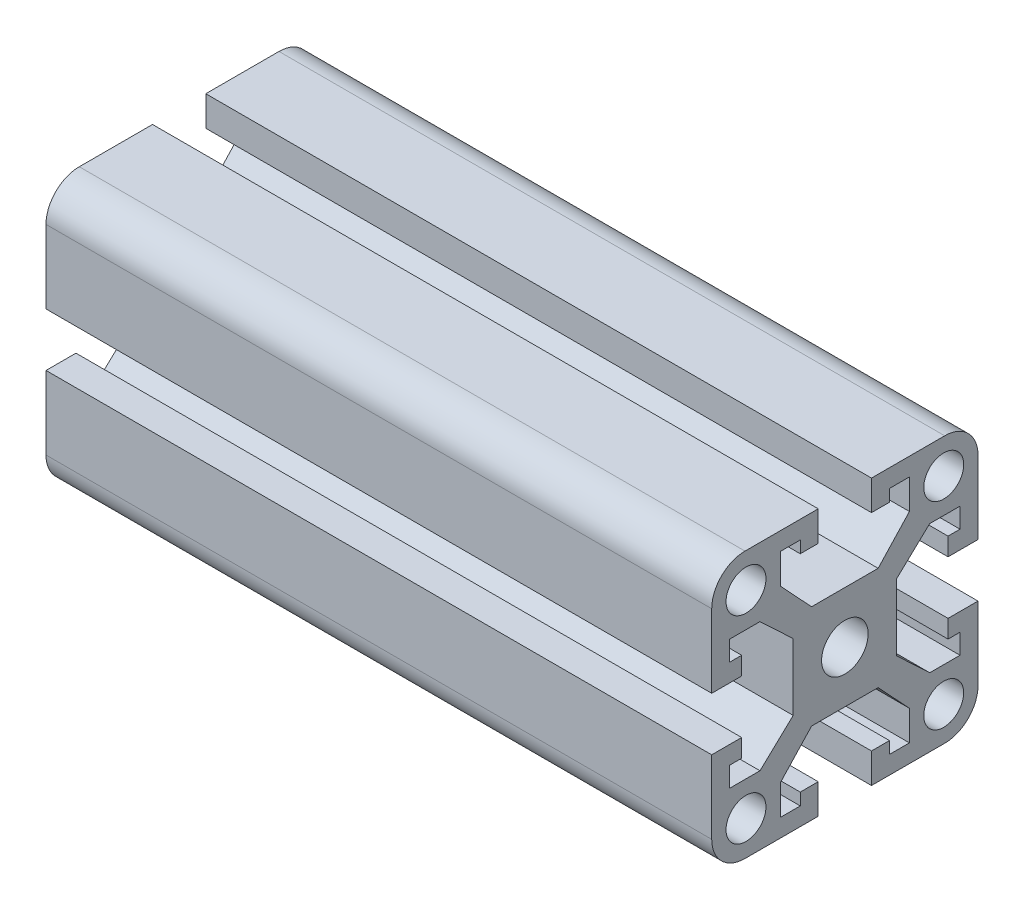
from build123d import *

# Parameters (mm, degrees)
SKETCH_1_W          = 40
SKETCH_1_H          = 40
EXTRUDE_1_DEPTH     = 100
CUT_EXTRUDE_1_REACH = 131.283
SKETCH_2_R          = 3.5
SKETCH_2_R_2        = 3
FILLET_1_R          = 5
SKETCH_3_R          = 1.236693346
CUT_EXTRUDE_2_DEPTH = 0.5


with BuildPart() as part:
    # 草图1 → 凸台-拉伸1 (new body)
    with BuildSketch(Plane(origin=(0, 0, 0), x_dir=(0, 0, -1), z_dir=(1, 0, 0))):
        with Locations((40.704960836, 35.035758607)):
            Rectangle(SKETCH_1_W, SKETCH_1_H)
    extrude(amount=EXTRUDE_1_DEPTH)

    # 草图2 → 切除-拉伸1 (cut, up to next)
    with BuildSketch(Plane(origin=(100, 0, 0), x_dir=(0, 0, -1), z_dir=(1, 0, 0)), mode=Mode.PRIVATE) as cut_extrude_1_sk1:
        with Locations((40.704960836, 35.035758607)):
            Circle(SKETCH_2_R)
    cut_extrude_1_tool1 = extrude(cut_extrude_1_sk1.sketch, amount=-CUT_EXTRUDE_1_REACH, mode=Mode.PRIVATE) & part.part
    # 草图2 → 切除-拉伸1 (cut, up to next)
    with BuildSketch(Plane(origin=(100, 0, 0), x_dir=(0, 0, -1), z_dir=(1, 0, 0)), mode=Mode.PRIVATE) as cut_extrude_1_sk2:
        with Locations((25.854960836, 49.885758607)):
            Circle(SKETCH_2_R_2)
    cut_extrude_1_tool2 = extrude(cut_extrude_1_sk2.sketch, amount=-CUT_EXTRUDE_1_REACH, mode=Mode.PRIVATE) & part.part
    # 草图2 → 切除-拉伸1 (cut, up to next)
    with BuildSketch(Plane(origin=(100, 0, 0), x_dir=(0, 0, -1), z_dir=(1, 0, 0)), mode=Mode.PRIVATE) as cut_extrude_1_sk3:
        with Locations((25.854960836, 20.185758607)):
            Circle(SKETCH_2_R_2)
    cut_extrude_1_tool3 = extrude(cut_extrude_1_sk3.sketch, amount=-CUT_EXTRUDE_1_REACH, mode=Mode.PRIVATE) & part.part
    # 草图2 → 切除-拉伸1 (cut, up to next)
    with BuildSketch(Plane(origin=(100, 0, 0), x_dir=(0, 0, -1), z_dir=(1, 0, 0)), mode=Mode.PRIVATE) as cut_extrude_1_sk4:
        with Locations((55.554960836, 49.885758607)):
            Circle(SKETCH_2_R_2)
    cut_extrude_1_tool4 = extrude(cut_extrude_1_sk4.sketch, amount=-CUT_EXTRUDE_1_REACH, mode=Mode.PRIVATE) & part.part
    # 草图2 → 切除-拉伸1 (cut, up to next)
    with BuildSketch(Plane(origin=(100, 0, 0), x_dir=(0, 0, -1), z_dir=(1, 0, 0)), mode=Mode.PRIVATE) as cut_extrude_1_sk5:
        with Locations((55.554960836, 20.185758607)):
            Circle(SKETCH_2_R_2)
    cut_extrude_1_tool5 = extrude(cut_extrude_1_sk5.sketch, amount=-CUT_EXTRUDE_1_REACH, mode=Mode.PRIVATE) & part.part
    # 草图2 → 切除-拉伸1 (cut, up to next)
    with BuildSketch(Plane(origin=(100, 0, 0), x_dir=(0, 0, -1), z_dir=(1, 0, 0)), mode=Mode.PRIVATE) as cut_extrude_1_sk6:
        Polygon((36.704960836, 15.035758607), (36.704960836, 19.535758607), (34.004960836, 19.535758607), (34.004960836, 17.735758607), (31.004960836, 17.735758607), (31.004960836, 22.235758607), (35.704960836, 27.275758607), (45.704960836, 27.275758607), (50.404960836, 22.235758607), (50.404960836, 17.735758607), (47.404960836, 17.735758607), (47.404960836, 19.535758607), (44.704960836, 19.535758607), (44.704960836, 15.035758607), align=None)
    cut_extrude_1_tool6 = extrude(cut_extrude_1_sk6.sketch, amount=-CUT_EXTRUDE_1_REACH, mode=Mode.PRIVATE) & part.part
    # 草图2 → 切除-拉伸1 (cut, up to next)
    with BuildSketch(Plane(origin=(100, 0, 0), x_dir=(0, 0, -1), z_dir=(1, 0, 0)), mode=Mode.PRIVATE) as cut_extrude_1_sk7:
        Polygon((44.704960836, 55.035758607), (44.704960836, 50.535758607), (47.404960836, 50.535758607), (47.404960836, 52.335758607), (50.404960836, 52.335758607), (50.404960836, 47.835758607), (45.704960836, 42.795758607), (35.704960836, 42.795758607), (31.004960836, 47.835758607), (31.004960836, 52.335758607), (34.004960836, 52.335758607), (34.004960836, 50.535758607), (36.704960836, 50.535758607), (36.704960836, 55.035758607), align=None)
    cut_extrude_1_tool7 = extrude(cut_extrude_1_sk7.sketch, amount=-CUT_EXTRUDE_1_REACH, mode=Mode.PRIVATE) & part.part
    # 草图2 → 切除-拉伸1 (cut, up to next)
    with BuildSketch(Plane(origin=(100, 0, 0), x_dir=(0, 0, -1), z_dir=(1, 0, 0)), mode=Mode.PRIVATE) as cut_extrude_1_sk8:
        Polygon((20.704960836, 31.035758607), (20.704960836, 39.035758607), (25.204960836, 39.035758607), (25.204960836, 41.735758607), (23.404960836, 41.735758607), (23.404960836, 44.735758607), (27.954960836, 44.735758607), (32.944960836, 40.035758607), (32.944960836, 30.035758607), (27.954960836, 25.335758607), (23.404960836, 25.335758607), (23.404960836, 28.335758607), (25.204960836, 28.335758607), (25.204960836, 31.035758607), align=None)
    cut_extrude_1_tool8 = extrude(cut_extrude_1_sk8.sketch, amount=-CUT_EXTRUDE_1_REACH, mode=Mode.PRIVATE) & part.part
    # 草图2 → 切除-拉伸1 (cut, up to next)
    with BuildSketch(Plane(origin=(100, 0, 0), x_dir=(0, 0, -1), z_dir=(1, 0, 0)), mode=Mode.PRIVATE) as cut_extrude_1_sk9:
        Polygon((60.704960836, 31.035758607), (56.204960836, 31.035758607), (56.204960836, 28.335758607), (58.004960836, 28.335758607), (58.004960836, 25.335758607), (53.454960836, 25.335758607), (48.464960836, 30.035758607), (48.464960836, 40.035758607), (53.454960836, 44.735758607), (58.004960836, 44.735758607), (58.004960836, 41.735758607), (56.204960836, 41.735758607), (56.204960836, 39.035758607), (60.704960836, 39.035758607), align=None)
    cut_extrude_1_tool9 = extrude(cut_extrude_1_sk9.sketch, amount=-CUT_EXTRUDE_1_REACH, mode=Mode.PRIVATE) & part.part
    add(cut_extrude_1_tool1.solids().sort_by_distance((100, 35.035759, -40.704961))[0], mode=Mode.SUBTRACT)
    add(cut_extrude_1_tool2.solids().sort_by_distance((100, 49.885759, -25.854961))[0], mode=Mode.SUBTRACT)
    add(cut_extrude_1_tool3.solids().sort_by_distance((100, 20.185759, -25.854961))[0], mode=Mode.SUBTRACT)
    add(cut_extrude_1_tool4.solids().sort_by_distance((100, 49.885759, -55.554961))[0], mode=Mode.SUBTRACT)
    add(cut_extrude_1_tool5.solids().sort_by_distance((100, 20.185759, -55.554961))[0], mode=Mode.SUBTRACT)
    add(cut_extrude_1_tool6.solids().sort_by_distance((100, 21.537481, -40.704961))[0], mode=Mode.SUBTRACT)
    add(cut_extrude_1_tool7.solids().sort_by_distance((100, 48.534036, -40.704961))[0], mode=Mode.SUBTRACT)
    add(cut_extrude_1_tool8.solids().sort_by_distance((100, 35.035759, -27.209927))[0], mode=Mode.SUBTRACT)
    add(cut_extrude_1_tool9.solids().sort_by_distance((100, 35.035759, -54.199995))[0], mode=Mode.SUBTRACT)

    # 圆角1
    fillet_1_edges = [part.edges().sort_by_distance(p)[0] for p in [
        (50, 55.035758607, -20.704960836),
        (50, 55.035758607, -60.704960836),
        (50, 15.035758607, -60.704960836),
        (50, 15.035758607, -20.704960836),
    ]]
    fillet(fillet_1_edges, radius=FILLET_1_R)

    # 草图3 → 切除-拉伸2 (cut)
    with BuildSketch(Plane(origin=(0, 42.795758607, 0), x_dir=(1, 0, 0), z_dir=(0, 1, 0))):
        with Locations(Location((50, 40.704960836, 0), (0, 0, 270))):
            Circle(SKETCH_3_R)
    extrude(amount=-CUT_EXTRUDE_2_DEPTH, mode=Mode.SUBTRACT)


solid = part.part
